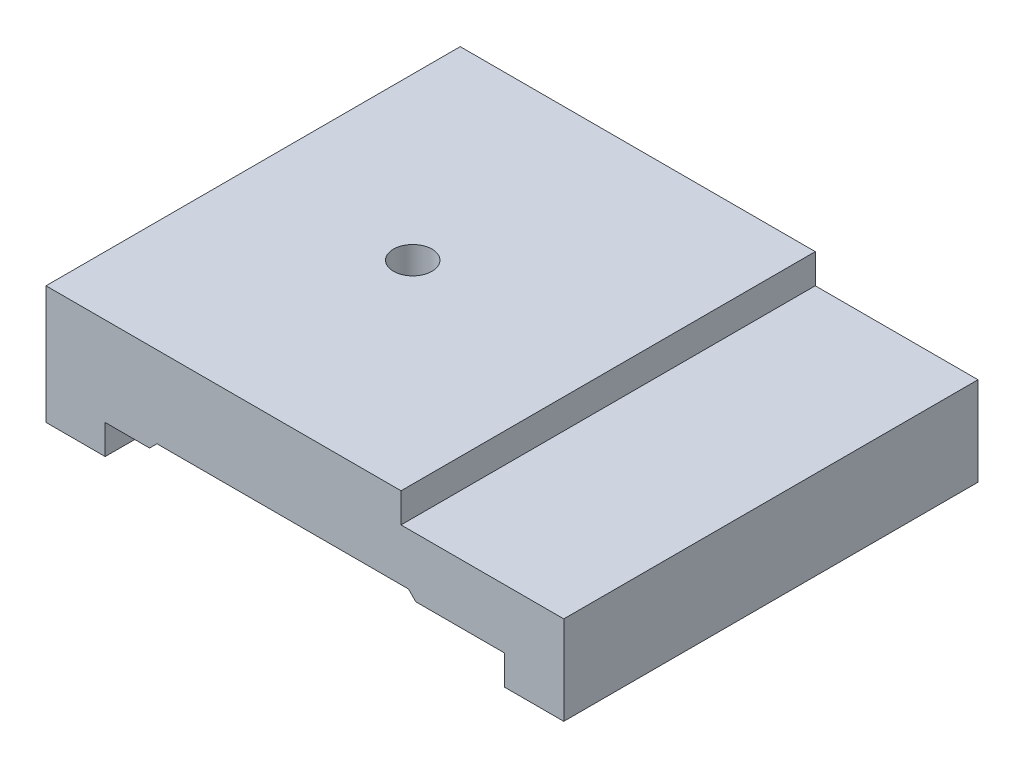
from build123d import *

# Parameters (mm, degrees)
SKETCH1_W           = 111.125
SKETCH1_H           = 88.9
BOSS_EXTRUDE1_DEPTH = 25.4
SKETCH2_W           = 34.925
SKETCH2_H           = 6.35
CUT_EXTRUDE1_DEPTH  = 108.868259494
SKETCH3_R           = 4.13258
CUT_EXTRUDE2_DEPTH  = 74.266177821


with BuildPart() as part:
    # Sketch1 → Boss-Extrude1 (new body)
    with BuildSketch(Plane(origin=(0, 0, 0), x_dir=(1, 0, 0), z_dir=(0, 1, 0))):
        Rectangle(SKETCH1_W, SKETCH1_H)
    extrude(amount=BOSS_EXTRUDE1_DEPTH)

    # Sketch2 → Cut-Extrude1 (cut, through all)
    with BuildSketch(Plane.XY.offset(44.45)):
        Polygon((-42.8625, 0), (-42.8625, 6.35), (-33.3375, 6.35), (-31.75, 7.9375), (22.225, 7.9375), (23.8125, 6.35), (42.8625, 6.35), (42.8625, 0), align=None)
        with Locations((38.1, 22.225)):
            Rectangle(SKETCH2_W, SKETCH2_H)
    extrude(amount=-CUT_EXTRUDE1_DEPTH, mode=Mode.SUBTRACT)

    # Sketch3 → Cut-Extrude2 (cut, through all)
    with BuildSketch(Plane.XZ.offset(-7.9375)):
        with Locations(Location((-20.962711313, 0.34070329, 0), (0, 0, 270))):
            Circle(SKETCH3_R)
    extrude(amount=-CUT_EXTRUDE2_DEPTH, mode=Mode.SUBTRACT)


solid = part.part
